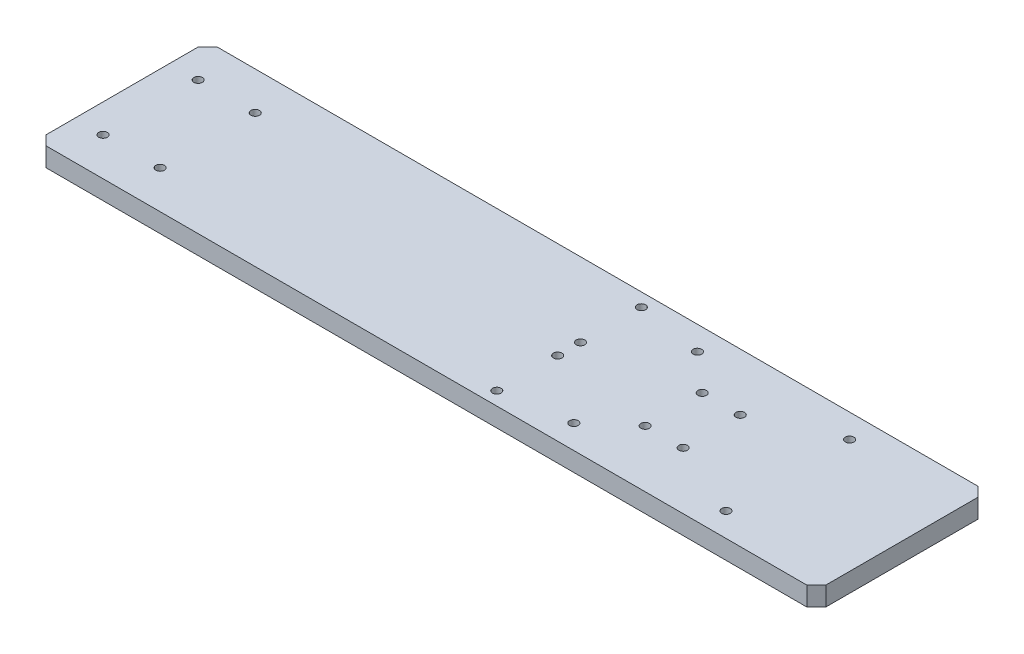
from build123d import *

# Parameters (mm, degrees)
CROQUIS1_W                                           = 410
CROQUIS1_H                                           = 90
SALIENTE_EXTRUIR1_DEPTH                              = 10
CHAFL_N1_SIZE                                        = 5
AVELLANADO_PARA_TORNILLO_CON_CABEZA_AVEL_D           = 4.5
AVELLANADO_PARA_TORNILLO_CON_CABEZA_AVEL_CSINK_D     = 9.18
AVELLANADO_PARA_TORNILLO_CON_CABEZA_AVEL_CSINK_ANGLE = 90
AVELLANADO_PARA_TORNILLO_CON_CABEZA_2_D              = 4.5
AVELLANADO_PARA_TORNILLO_CON_CABEZA_2_CSINK_D        = 9.18
AVELLANADO_PARA_TORNILLO_CON_CABEZA_2_CSINK_ANGLE    = 90
AVELLANADO_PARA_TORNILLO_CON_CABEZA_3_D              = 4.5
AVELLANADO_PARA_TORNILLO_CON_CABEZA_3_CSINK_D        = 9.18
AVELLANADO_PARA_TORNILLO_CON_CABEZA_3_CSINK_ANGLE    = 90
AVELLANADO_PARA_TORNILLO_CON_CABEZA_4_D              = 4.5
AVELLANADO_PARA_TORNILLO_CON_CABEZA_4_CSINK_D        = 9.18
AVELLANADO_PARA_TORNILLO_CON_CABEZA_4_CSINK_ANGLE    = 90


with BuildPart() as part:
    # Croquis1 → Saliente-Extruir1 (new body)
    with BuildSketch(Plane(origin=(0, 0, 0), x_dir=(1, 0, 0), z_dir=(0, 1, 0))):
        with Locations((205, 0)):
            Rectangle(CROQUIS1_W, CROQUIS1_H)
    extrude(amount=SALIENTE_EXTRUIR1_DEPTH)

    # Chaflán1
    chafl_n1_edges = [part.edges().sort_by_distance(p)[0] for p in [
        (410, 5, 45),
        (0, 5, 45),
        (0, 5, -45),
        (410, 5, -45),
    ]]
    chamfer(chafl_n1_edges, length=CHAFL_N1_SIZE)

    # Avellanado para tornillo con cabeza avel (through all)
    with Locations(Plane(origin=(0, 0, 0), x_dir=(-1, 0, 0), z_dir=(0, -1, 0))):
        with Locations((-15, -25), (-45, 25), (-45, -25), (-15, 25)):
            CounterSinkHole(AVELLANADO_PARA_TORNILLO_CON_CABEZA_AVEL_D / 2, AVELLANADO_PARA_TORNILLO_CON_CABEZA_AVEL_CSINK_D / 2, counter_sink_angle=AVELLANADO_PARA_TORNILLO_CON_CABEZA_AVEL_CSINK_ANGLE)

    # Avellanado para tornillo con cabeza  2 (through all)
    with Locations(Plane(origin=(0, 0, 0), x_dir=(-1, 0, 0), z_dir=(0, -1, 0))):
        with Locations((-235, 38), (-235, 6), (-235, -6), (-235, -38)):
            CounterSinkHole(AVELLANADO_PARA_TORNILLO_CON_CABEZA_2_D / 2, AVELLANADO_PARA_TORNILLO_CON_CABEZA_2_CSINK_D / 2, counter_sink_angle=AVELLANADO_PARA_TORNILLO_CON_CABEZA_2_CSINK_ANGLE)

    # Avellanado para tornillo con cabeza  3 (through all)
    with Locations(Plane(origin=(0, 0, 0), x_dir=(-1, 0, 0), z_dir=(0, -1, 0))):
        with Locations((-290, 15), (-310, -15), (-310, 15), (-290, -15)):
            CounterSinkHole(AVELLANADO_PARA_TORNILLO_CON_CABEZA_3_D / 2, AVELLANADO_PARA_TORNILLO_CON_CABEZA_3_CSINK_D / 2, counter_sink_angle=AVELLANADO_PARA_TORNILLO_CON_CABEZA_3_CSINK_ANGLE)

    # Avellanado para tornillo con cabeza  4 (through all)
    with Locations(Plane(origin=(0, 0, 0), x_dir=(-1, 0, 0), z_dir=(0, -1, 0))):
        with Locations((-270, 32.5), (-350, -32.5), (-350, 32.5), (-270, -32.5)):
            CounterSinkHole(AVELLANADO_PARA_TORNILLO_CON_CABEZA_4_D / 2, AVELLANADO_PARA_TORNILLO_CON_CABEZA_4_CSINK_D / 2, counter_sink_angle=AVELLANADO_PARA_TORNILLO_CON_CABEZA_4_CSINK_ANGLE)


solid = part.part
